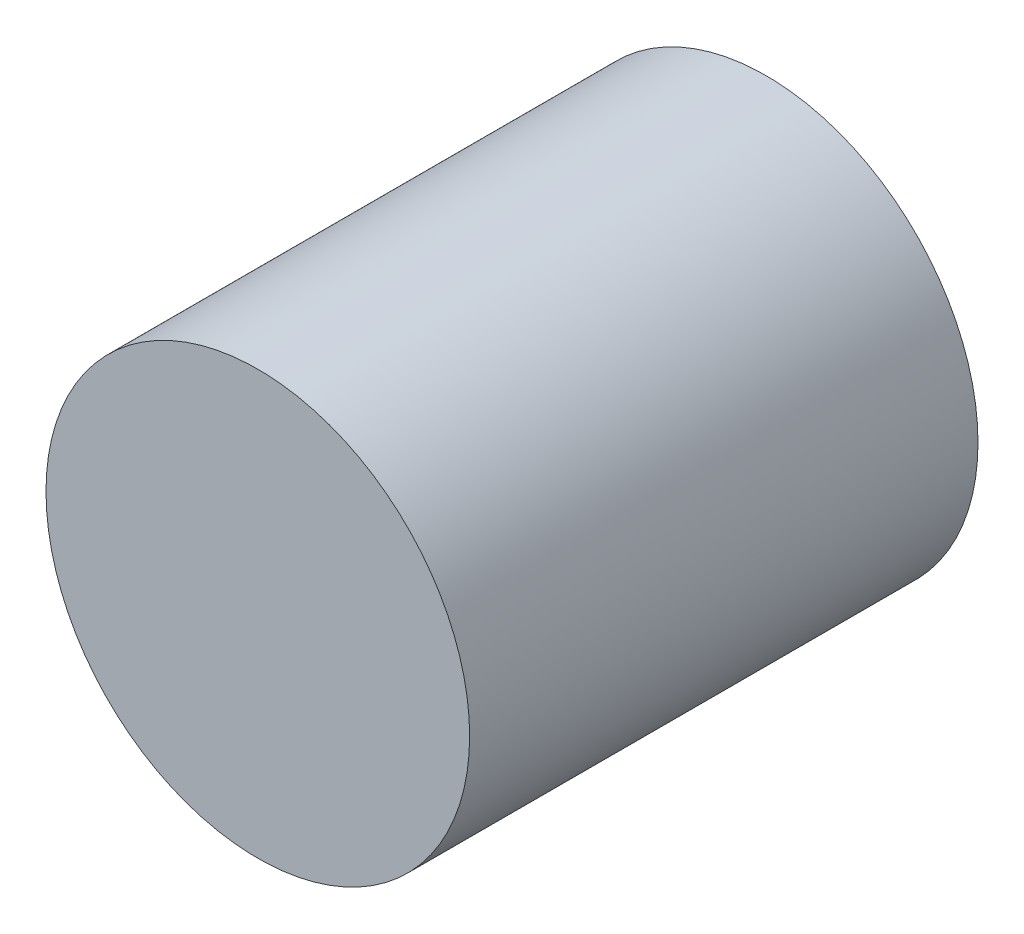
from build123d import *

# Parameters (mm, degrees)
SKETCH_1_R      = 3.75
EXTRUDE_1_DEPTH = 9


with BuildPart() as part:
    # Эскиз1 → Вытянуть1 (new body)
    with BuildSketch(Plane.XY):
        Circle(SKETCH_1_R)
    extrude(amount=EXTRUDE_1_DEPTH)


solid = part.part
